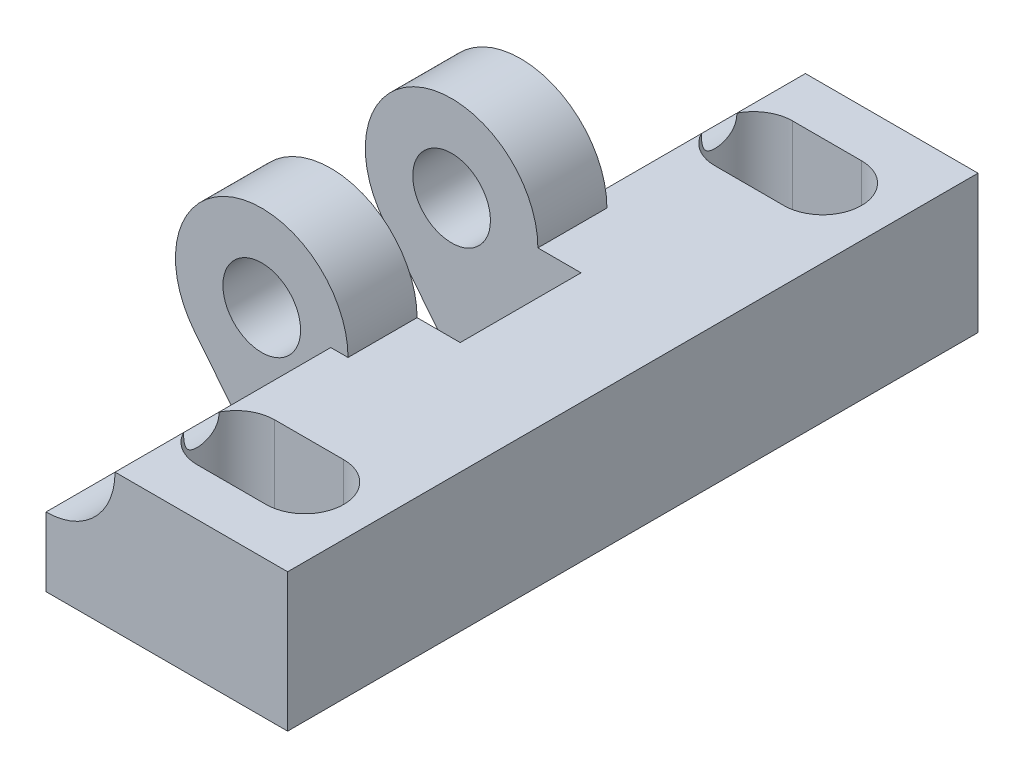
from build123d import *

# Parameters (mm, degrees)
SKETCH1_W               = 13
SKETCH1_H               = 15
BOSS_EXTRUDE1_DEPTH     = 8
BOSS_EXTRUDE2_DEPTH     = 4
SKETCH6_W               = 14
SKETCH6_H               = 40
BOSS_EXTRUDE3_DEPTH     = 8
SKETCH3_R               = 7.5
CUT_EXTRUDE1_DEPTH      = 7
CUT_EXTRUDE2_DEPTH      = 36.344730866
CUT_EXTRUDE2_DEPTH_BACK = 36.344730866
SKETCH4_R               = 2.25
SKETCH7_R               = 4
CUT_EXTRUDE3_DEPTH      = 36.344730866


with BuildPart() as part:
    # Sketch1 → Boss-Extrude1 (new body)
    with BuildSketch(Plane(origin=(0, 0, 0), x_dir=(1, 0, 0), z_dir=(0, 1, 0))):
        with Locations((-6.5, 0)):
            Rectangle(SKETCH1_W, SKETCH1_H)
    extrude(amount=BOSS_EXTRUDE1_DEPTH)

    # Sketch2 → Boss-Extrude2 (add)
    with BuildSketch(Plane.XY.offset(7.5)):
        with BuildLine():
            Line((-16.903123749, 4.875), (-13, 0))
            Line((-13, 0), (-13, 3))
            ThreePointArc((-13, 3), (-10.834936491, 12.506939094), (-16.903123749, 4.875))
        make_face()
    boss_extrude2 = extrude(amount=-BOSS_EXTRUDE2_DEPTH)

    # Mirror1: Boss-Extrude2 across plane
    add(boss_extrude2.mirror(Plane.XY))

    # Sketch6 → Boss-Extrude3 (add)
    with BuildSketch(Plane.XZ):
        with Locations((-6, 0)):
            Rectangle(SKETCH6_W, SKETCH6_H)
        with BuildLine():
            Line((-7, 17.25), (-3, 17.25))
            ThreePointArc((-3, 17.25), (-0.75, 15), (-3, 12.75))
            Line((-3, 12.75), (-7, 12.75))
            ThreePointArc((-7, 12.75), (-9.25, 15), (-7, 17.25))
        make_face(mode=Mode.SUBTRACT)
        with BuildLine():
            Line((-7, -12.75), (-3, -12.75))
            ThreePointArc((-3, -12.75), (-0.75, -15), (-3, -17.25))
            Line((-3, -17.25), (-7, -17.25))
            ThreePointArc((-7, -17.25), (-9.25, -15), (-7, -12.75))
        make_face(mode=Mode.SUBTRACT)
    extrude(amount=-BOSS_EXTRUDE3_DEPTH)

    # Sketch3 → Cut-Extrude1 (cut)
    with BuildSketch(Plane.XY.offset(-3.5)):
        with Locations((-13, 8)):
            Circle(SKETCH3_R)
    extrude(amount=CUT_EXTRUDE1_DEPTH, mode=Mode.SUBTRACT)

    # Sketch4 → Cut-Extrude2 (cut, two sides: drawn at the far end of the back side and taken through both)
    with BuildSketch(Plane.XY.offset(7.5).offset(-CUT_EXTRUDE2_DEPTH_BACK)):
        with Locations((-13, 8)):
            Circle(SKETCH4_R)
    extrude(amount=CUT_EXTRUDE2_DEPTH + CUT_EXTRUDE2_DEPTH_BACK, mode=Mode.SUBTRACT)

    # Sketch7 → Cut-Extrude3 (cut, through all)
    with BuildSketch(Plane.XY.offset(7.5)):
        with Locations((-13, 8)):
            Circle(SKETCH7_R)
    cut_extrude3 = extrude(amount=CUT_EXTRUDE3_DEPTH, mode=Mode.SUBTRACT)

    # Mirror2: Cut-Extrude3 across plane
    add(cut_extrude3.mirror(Plane.XY), mode=Mode.SUBTRACT)


solid = part.part
